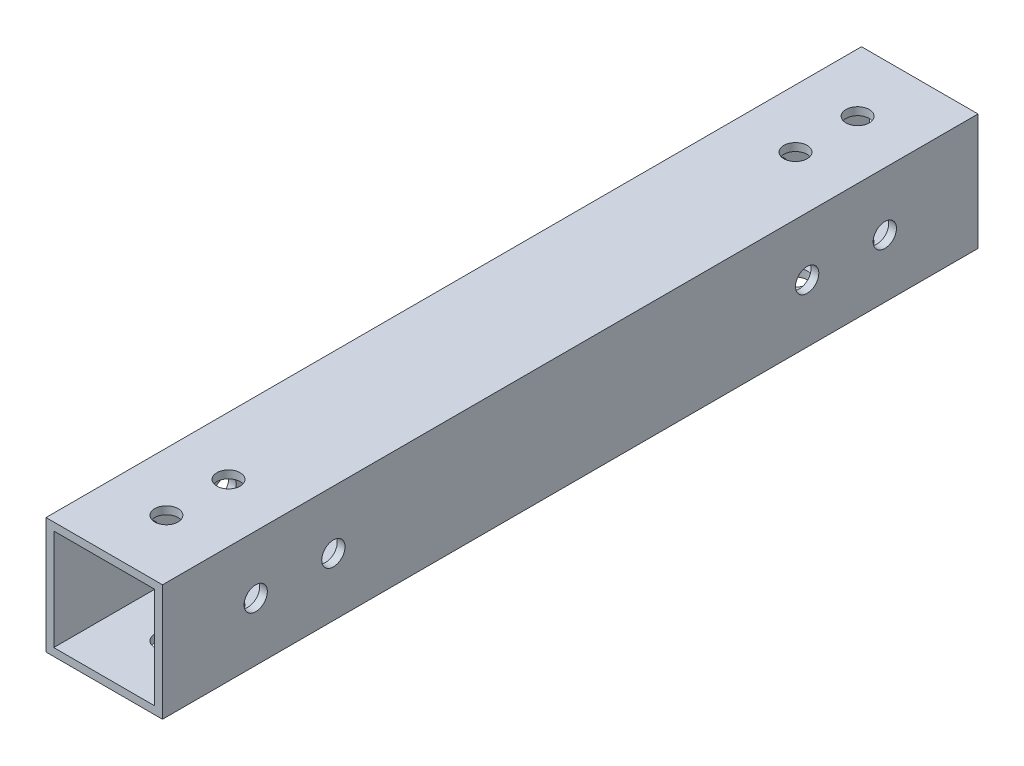
from build123d import *

# Parameters (mm, degrees)
SKETCH_1_W          = 15
SKETCH_1_H          = 15
SKETCH_1_W_2        = 13
SKETCH_1_H_2        = 13
EXTRUDE_1_DEPTH     = 105
SKETCH_3_R          = 1.5
CUT_EXTRUDE_2_DEPTH = 107.330851591
SKETCH_4_R          = 1.5
CUT_EXTRUDE_3_DEPTH = 107.330851591


with BuildPart() as part:
    # 草图1 → 凸台-拉伸1 (new body)
    with BuildSketch(Plane.XY):
        Rectangle(SKETCH_1_W, SKETCH_1_H)
        Rectangle(SKETCH_1_W_2, SKETCH_1_H_2, mode=Mode.SUBTRACT)
    extrude(amount=EXTRUDE_1_DEPTH)

    # 草图3 → 切除-拉伸2 (cut, through all)
    with BuildSketch(Plane(origin=(0, 7.5, 0), x_dir=(1, 0, 0), z_dir=(0, 1, 0))):
        with Locations(Location((0, -97, 0), (0, 0, 270))):
            Circle(SKETCH_3_R)
        with Locations(Location((0, -89, 0), (0, 0, 270))):
            Circle(SKETCH_3_R)
        with Locations(Location((0, -16, 0), (0, 0, 270))):
            Circle(SKETCH_3_R)
        with Locations(Location((0, -8, 0), (0, 0, 270))):
            Circle(SKETCH_3_R)
    extrude(amount=-CUT_EXTRUDE_2_DEPTH, mode=Mode.SUBTRACT)

    # 草图4 → 切除-拉伸3 (cut, through all)
    with BuildSketch(Plane.ZY.offset(7.5)):
        with Locations((93, 0)):
            Circle(SKETCH_4_R)
        with Locations((83, 0)):
            Circle(SKETCH_4_R)
        with Locations((12, 0)):
            Circle(SKETCH_4_R)
        with Locations((22, 0)):
            Circle(SKETCH_4_R)
    extrude(amount=-CUT_EXTRUDE_3_DEPTH, mode=Mode.SUBTRACT)


solid = part.part
